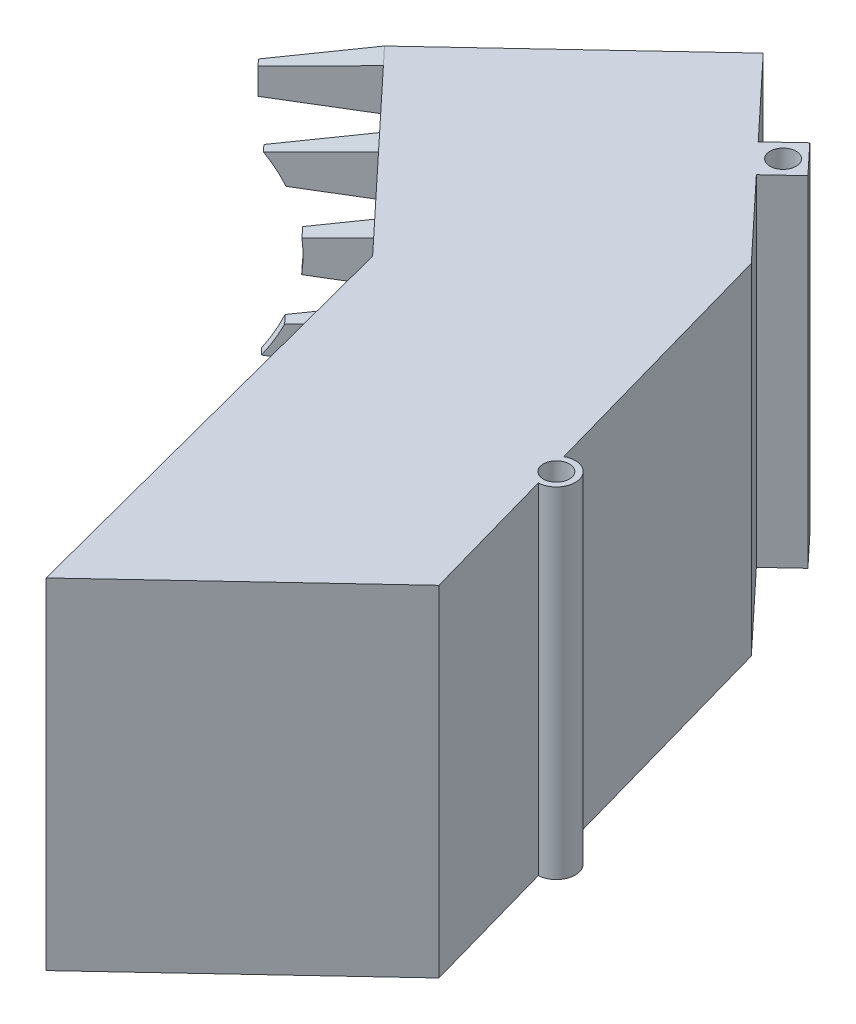
from build123d import *

# Parameters (mm, degrees)
SKETCH1_R                     = 3.175
BOSS_EXTRUDE2_DEPTH           = 76.2
SKETCH1_5_R                   = 3.175
BOSS_EXTRUDE3_DEPTH           = 6.35
SKETCH5_R                     = 3.175
BOSS_EXTRUDE4_DEPTH           = 6.35
SKETCH6_W                     = 50.8
SKETCH6_H                     = 50.8
CUT_EXTRUDE1_DEPTH            = 21.59
SKETCH7_W                     = 5.86068256
SKETCH7_H                     = 10.16
BOSS_EXTRUDE5_DEPTH           = 21.59
BOSS_EXTRUDE5_DRAFT           = 5
BOSS_EXTRUDE5_PROFILE_2_DEPTH = 21.59
BOSS_EXTRUDE5_PROFILE_2_DRAFT = 5
BOSS_EXTRUDE5_PROFILE_3_DEPTH = 21.59
BOSS_EXTRUDE5_PROFILE_3_DRAFT = 5
BOSS_EXTRUDE5_PROFILE_4_DEPTH = 21.59
BOSS_EXTRUDE5_PROFILE_4_DRAFT = 5
BOSS_EXTRUDE5_PROFILE_5_DEPTH = 21.59
BOSS_EXTRUDE5_PROFILE_5_DRAFT = 5
SKETCH10_R                    = 36.051864109
CUT_EXTRUDE2_DEPTH            = 21.59


with BuildPart() as part:
    # Sketch1 → Boss-Extrude2 (new body)
    with BuildSketch(Plane(origin=(0, 0, 0), x_dir=(1, 0, 0), z_dir=(0, 1, 0))):
        with BuildLine():
            Line((-4.208751998, -43.475305064), (45.017746951, 2.631829887))
            Line((45.017746951, 2.631829887), (35.550660053, 36.209226482))
            ThreePointArc((35.550660053, 36.209226482), (39.762177432, 42.05307025), (33.11828595, 44.83625091))
            Line((33.11828595, 44.83625091), (15.243844224, 108.232438689))
            Line((15.243844224, 108.232438689), (-2.783728935, 127.479661752))
            Line((-2.783728935, 127.479661752), (3.678966496, 133.532831827))
            Line((3.678966496, 133.532831827), (-3.005742225, 140.669792455))
            Line((-3.005742225, 140.669792455), (-9.468437655, 134.61662238))
            Line((-9.468437655, 134.61662238), (-27.496010814, 153.863845442))
            Line((-27.496010814, 153.863845442), (-74.966911398, 109.401060841))
            Line((-74.966911398, 109.401060841), (-32.227053049, 63.769650553))
            Line((-32.227053049, 63.769650553), (-4.208751998, -43.475305064))
        make_face()
        with Locations((35.334305242, 40.804639607)):
            Circle(SKETCH1_R, mode=Mode.SUBTRACT)
        with BuildLine():
            Line((-27.946524097, 65.532765046), (-68.844709626, 109.197904706))
            Line((-68.844709626, 109.197904706), (-27.496010814, 147.926436632))
            Line((-27.496010814, 147.926436632), (12.111157264, 105.390011693))
            Line((12.111157264, 105.390011693), (34.544848217, 24.491577435))
            ThreePointArc((34.544848217, 24.491577435), (36.285698832, 19.303992732), (36.875100326, 13.863937421))
            ThreePointArc((36.875100326, 13.863937421), (14.585843996, -11.34485616), (-13.162952731, 7.689284266))
            Line((-13.162952731, 7.689284266), (-27.946524097, 65.532765046))
        make_face(mode=Mode.SUBTRACT)
        with Locations((-2.894634056, 134.074815557)):
            Circle(SKETCH1_R, mode=Mode.SUBTRACT)
    extrude(amount=BOSS_EXTRUDE2_DEPTH)

    # Sketch1<5> → Boss-Extrude3 (add)
    with BuildSketch(Plane(origin=(0, 0, 0), x_dir=(1, 0, 0), z_dir=(0, 1, 0))):
        with BuildLine():
            Line((-27.496010814, 147.926436632), (-68.844709626, 109.197904706))
            Line((-68.844709626, 109.197904706), (-27.946524097, 65.532765046))
            Line((-27.946524097, 65.532765046), (-13.162952731, 7.689284266))
            ThreePointArc((-13.162952731, 7.689284266), (3.03743719, 37.821521623), (34.544848217, 24.491577435))
            Line((34.544848217, 24.491577435), (12.111157264, 105.390011693))
            Line((12.111157264, 105.390011693), (-27.496010814, 147.926436632))
        make_face()
        with Locations((-32.808552916, 77.429328599)):
            Circle(SKETCH1_5_R, mode=Mode.SUBTRACT)
        with Locations((-1.199981142, 109.041759799)):
            Circle(SKETCH1_5_R, mode=Mode.SUBTRACT)
    extrude(amount=BOSS_EXTRUDE3_DEPTH)

    # Sketch5 → Boss-Extrude4 (add)
    with BuildSketch(Plane(origin=(0, 76.2, 0), x_dir=(1, 0, 0), z_dir=(0, 1, 0))):
        with BuildLine():
            Line((45.017746951, 2.631829887), (35.550660053, 36.209226482))
            ThreePointArc((35.550660053, 36.209226482), (39.762177432, 42.05307025), (33.11828595, 44.83625091))
            Line((33.11828595, 44.83625091), (15.243844224, 108.232438689))
            Line((15.243844224, 108.232438689), (-2.783728935, 127.479661752))
            Line((-2.783728935, 127.479661752), (3.678966496, 133.532831827))
            Line((3.678966496, 133.532831827), (-3.005742225, 140.669792455))
            Line((-3.005742225, 140.669792455), (-9.468437655, 134.61662238))
            Line((-9.468437655, 134.61662238), (-27.496010814, 153.863845442))
            Line((-27.496010814, 153.863845442), (-74.966911398, 109.401060841))
            Line((-74.966911398, 109.401060841), (-32.227053049, 63.769650553))
            Line((-32.227053049, 63.769650553), (-4.208751998, -43.475305064))
            Line((-4.208751998, -43.475305064), (45.017746951, 2.631829887))
        make_face()
        with Locations((-2.894634056, 134.074815557)):
            Circle(SKETCH5_R, mode=Mode.SUBTRACT)
        with Locations((35.334305242, 40.804639607)):
            Circle(SKETCH5_R, mode=Mode.SUBTRACT)
    extrude(amount=BOSS_EXTRUDE4_DEPTH)

    # Sketch6 → Cut-Extrude1 (cut)
    with BuildSketch(Plane(origin=(14.64974053, 0, -13.721421958), x_dir=(0.683604049055853, 0, 0.729853070223345), z_dir=(-0.729853070223345, 0, 0.683604049055853))):
        with Locations((-99.833701757, 41.275)):
            Rectangle(SKETCH6_W, SKETCH6_H)
    extrude(amount=-CUT_EXTRUDE1_DEPTH, mode=Mode.SUBTRACT)


with BuildPart() as boss_extrude5_tool:
    # Sketch7 → Boss-Extrude5 (with draft: the straight prism first)
    with BuildSketch(Plane(origin=(14.64974053, 0, -13.721421958), x_dir=(0.683604049055853, 0, 0.729853070223345), z_dir=(-0.729853070223345, 0, 0.683604049055853))):
        with Locations((-128.164043037, 77.47)):
            Rectangle(SKETCH7_W, SKETCH7_H)
    extrude(amount=BOSS_EXTRUDE5_DEPTH)
    # Boss-Extrude5: the draft: its side faces are tilted about the plane it starts from
    boss_extrude5_sides = [boss_extrude5_tool.faces().sort_by_distance(p)[0] for p in [
        (-82.845675291, 77.47, -102.021555132),
        (-80.842482126, 72.39, -99.882836552),
        (-78.839288962, 77.47, -97.744117972),
        (-80.842482126, 82.55, -99.882836552),
    ]]
    draft(boss_extrude5_sides, Plane(origin=(14.64974053, 0, -13.721421958), x_dir=(0.683604049055853, 0, 0.729853070223345), z_dir=(-0.729853070223345, 0, 0.683604049055853)), BOSS_EXTRUDE5_DRAFT)


with BuildPart() as part_1:
    add(part.part)

    # Boss-Extrude5: add boss_extrude5_tool
    add(boss_extrude5_tool.part)


with BuildPart() as boss_extrude5_profile_2_tool:
    # Sketch7 → Boss-Extrude5 profile 2 (with draft: the straight prism first)
    with BuildSketch(Plane(origin=(14.64974053, 0, -13.721421958), x_dir=(0.683604049055853, 0, 0.729853070223345), z_dir=(-0.729853070223345, 0, 0.683604049055853))):
        with Locations((-128.164043037, 59.3725)):
            Rectangle(SKETCH7_W, SKETCH7_H)
    extrude(amount=BOSS_EXTRUDE5_PROFILE_2_DEPTH)
    # Boss-Extrude5 profile 2: the draft: its side faces are tilted about the plane it starts from
    boss_extrude5_profile_2_sides = [boss_extrude5_profile_2_tool.faces().sort_by_distance(p)[0] for p in [
        (-80.842482126, 54.2925, -99.882836552),
        (-78.839288962, 59.3725, -97.744117972),
        (-80.842482126, 64.4525, -99.882836552),
        (-82.845675291, 59.3725, -102.021555132),
    ]]
    draft(boss_extrude5_profile_2_sides, Plane(origin=(14.64974053, 0, -13.721421958), x_dir=(0.683604049055853, 0, 0.729853070223345), z_dir=(-0.729853070223345, 0, 0.683604049055853)), BOSS_EXTRUDE5_PROFILE_2_DRAFT)


with BuildPart() as part_2:
    add(part_1.part)

    # Boss-Extrude5 profile 2: add boss_extrude5_profile_2_tool
    add(boss_extrude5_profile_2_tool.part)


with BuildPart() as boss_extrude5_profile_3_tool:
    # Sketch7 → Boss-Extrude5 profile 3 (with draft: the straight prism first)
    with BuildSketch(Plane(origin=(14.64974053, 0, -13.721421958), x_dir=(0.683604049055853, 0, 0.729853070223345), z_dir=(-0.729853070223345, 0, 0.683604049055853))):
        with Locations((-128.164043037, 41.275)):
            Rectangle(SKETCH7_W, SKETCH7_H)
    extrude(amount=BOSS_EXTRUDE5_PROFILE_3_DEPTH)
    # Boss-Extrude5 profile 3: the draft: its side faces are tilted about the plane it starts from
    boss_extrude5_profile_3_sides = [boss_extrude5_profile_3_tool.faces().sort_by_distance(p)[0] for p in [
        (-80.842482126, 36.195, -99.882836552),
        (-78.839288962, 41.275, -97.744117972),
        (-80.842482126, 46.355, -99.882836552),
        (-82.845675291, 41.275, -102.021555132),
    ]]
    draft(boss_extrude5_profile_3_sides, Plane(origin=(14.64974053, 0, -13.721421958), x_dir=(0.683604049055853, 0, 0.729853070223345), z_dir=(-0.729853070223345, 0, 0.683604049055853)), BOSS_EXTRUDE5_PROFILE_3_DRAFT)


with BuildPart() as part_3:
    add(part_2.part)

    # Boss-Extrude5 profile 3: add boss_extrude5_profile_3_tool
    add(boss_extrude5_profile_3_tool.part)


with BuildPart() as boss_extrude5_profile_4_tool:
    # Sketch7 → Boss-Extrude5 profile 4 (with draft: the straight prism first)
    with BuildSketch(Plane(origin=(14.64974053, 0, -13.721421958), x_dir=(0.683604049055853, 0, 0.729853070223345), z_dir=(-0.729853070223345, 0, 0.683604049055853))):
        with Locations((-128.164043037, 23.1775)):
            Rectangle(SKETCH7_W, SKETCH7_H)
    extrude(amount=BOSS_EXTRUDE5_PROFILE_4_DEPTH)
    # Boss-Extrude5 profile 4: the draft: its side faces are tilted about the plane it starts from
    boss_extrude5_profile_4_sides = [boss_extrude5_profile_4_tool.faces().sort_by_distance(p)[0] for p in [
        (-80.842482126, 18.0975, -99.882836552),
        (-78.839288962, 23.1775, -97.744117972),
        (-80.842482126, 28.2575, -99.882836552),
        (-82.845675291, 23.1775, -102.021555132),
    ]]
    draft(boss_extrude5_profile_4_sides, Plane(origin=(14.64974053, 0, -13.721421958), x_dir=(0.683604049055853, 0, 0.729853070223345), z_dir=(-0.729853070223345, 0, 0.683604049055853)), BOSS_EXTRUDE5_PROFILE_4_DRAFT)


with BuildPart() as part_4:
    add(part_3.part)

    # Boss-Extrude5 profile 4: add boss_extrude5_profile_4_tool
    add(boss_extrude5_profile_4_tool.part)


with BuildPart() as boss_extrude5_profile_5_tool:
    # Sketch7 → Boss-Extrude5 profile 5 (with draft: the straight prism first)
    with BuildSketch(Plane(origin=(14.64974053, 0, -13.721421958), x_dir=(0.683604049055853, 0, 0.729853070223345), z_dir=(-0.729853070223345, 0, 0.683604049055853))):
        with Locations((-128.164043037, 5.08)):
            Rectangle(SKETCH7_W, SKETCH7_H)
    extrude(amount=BOSS_EXTRUDE5_PROFILE_5_DEPTH)
    # Boss-Extrude5 profile 5: the draft: its side faces are tilted about the plane it starts from
    boss_extrude5_profile_5_sides = [boss_extrude5_profile_5_tool.faces().sort_by_distance(p)[0] for p in [
        (-80.842482126, 0, -99.882836552),
        (-78.839288962, 5.08, -97.744117972),
        (-80.842482126, 10.16, -99.882836552),
        (-82.845675291, 5.08, -102.021555132),
    ]]
    draft(boss_extrude5_profile_5_sides, Plane(origin=(14.64974053, 0, -13.721421958), x_dir=(0.683604049055853, 0, 0.729853070223345), z_dir=(-0.729853070223345, 0, 0.683604049055853)), BOSS_EXTRUDE5_PROFILE_5_DRAFT)


with BuildPart() as part_5:
    add(part_4.part)

    # Boss-Extrude5 profile 5: add boss_extrude5_profile_5_tool
    add(boss_extrude5_profile_5_tool.part)

    # Sketch10 → Cut-Extrude2 (cut)
    with BuildSketch(Plane(origin=(-89.616651928, 0, -95.679638883), x_dir=(-0.7298530702233451, 0, 0.683604049055853), z_dir=(-0.683604049055853, 0, -0.7298530702233451))):
        with Locations((29.820674878, 41.547690044)):
            Circle(SKETCH10_R)
    extrude(amount=-CUT_EXTRUDE2_DEPTH, mode=Mode.SUBTRACT)


solid = part_5.part
